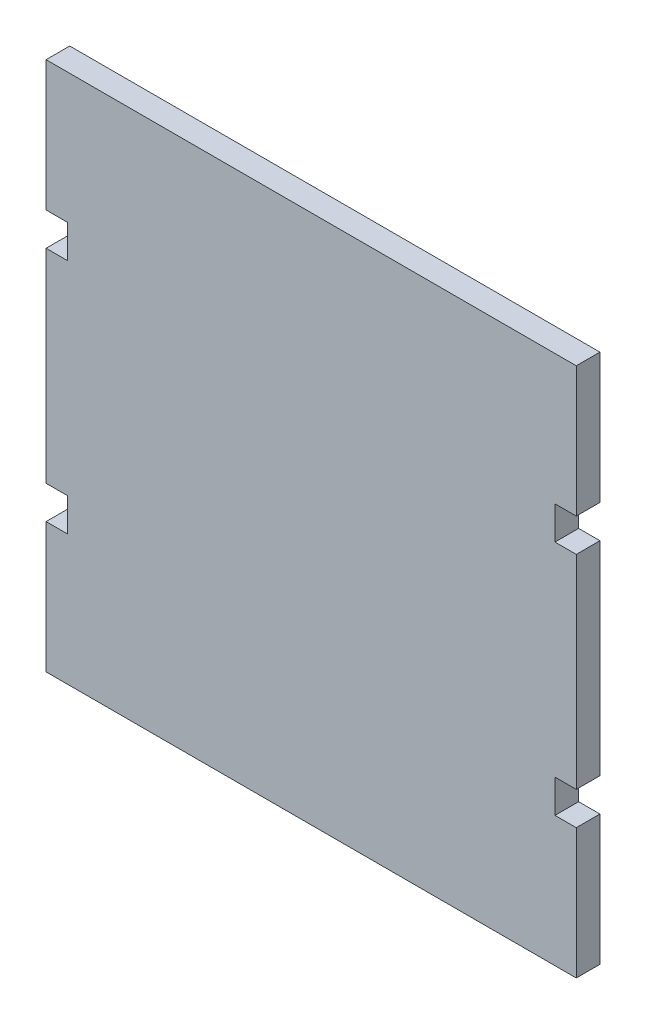
from build123d import *

# Parameters (mm, degrees)
BOSS_EXTRU_1_DEPTH = 50


with BuildPart() as part:
    # Esquisse1 → Boss.-Extru.1 (new body)
    with BuildSketch(Plane.XY):
        Polygon((560, -560), (-560, -560), (-560, -285), (-515, -285), (-515, -215), (-560, -215), (-560, 215), (-515, 215), (-515, 285), (-560, 285), (-560, 560), (560, 560), (560, 285), (515, 285), (515, 215), (560, 215), (560, -215), (515, -215), (515, -285), (560, -285), align=None)
    extrude(amount=-BOSS_EXTRU_1_DEPTH)


solid = part.part
